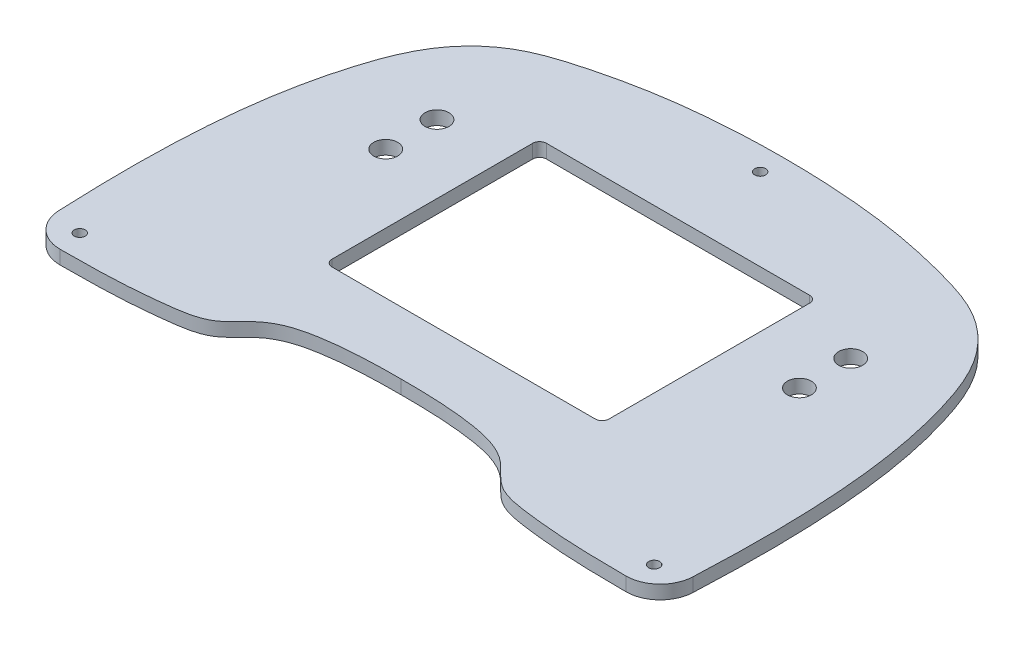
from build123d import *

# Parameters (mm, degrees)
SKETCH1_W           = 240
SKETCH1_H           = 310
BOSS_EXTRUDE1_DEPTH = 4
CUT_EXTRUDE1_REACH  = 198.064
SKETCH2_R           = 1.75
CUT_EXTRUDE2_REACH  = 198.064
SKETCH3_R           = 1.75
FILLET3_R           = 3
SKETCH4_R           = 1.6
CUT_EXTRUDE3_DEPTH  = 5
FILLET4_R           = 10
SKETCH5_R           = 1.6
CUT_EXTRUDE4_DEPTH  = 168.426582877
SKETCH6_W           = 37.6
SKETCH6_H           = 62.7
SKETCH6_W_2         = 5.8
CUT_EXTRUDE5_DEPTH  = 168.426582877
SKETCH7_R           = 3.5
CUT_EXTRUDE6_DEPTH  = 168.426582877
FILLET5_R           = 2


with BuildPart() as part:
    # Sketch1 → Boss-Extrude1 (new body)
    with BuildSketch(Plane(origin=(0, 0, 0), x_dir=(1, 0, 0), z_dir=(0, 1, 0))):
        Rectangle(SKETCH1_W, SKETCH1_H)
    extrude(amount=BOSS_EXTRUDE1_DEPTH)

    # Sketch2 → Cut-Extrude1 (cut, up to next)
    with BuildSketch(Plane(origin=(0, 4, 0), x_dir=(1, 0, 0), z_dir=(0, 1, 0)), mode=Mode.PRIVATE) as cut_extrude1_sk1:
        with BuildLine():
            Line((-120, 155), (-120, 0))
            add(Edge.make_bspline(
                [(0, 155), (-30.572222193, 155), (-80.343316982, 153.733320995), (-119.221157946, 117.654395612), (-120, 45.41001223), (-120, 0)],
                knots=[0, 0, 0, 0, 0.458017491, 0.558017491, 1, 1, 1, 1], degree=3))
            Line((0, 155), (-120, 155))
        make_face()
    cut_extrude1_tool1 = extrude(cut_extrude1_sk1.sketch, amount=-CUT_EXTRUDE1_REACH, mode=Mode.PRIVATE) & part.part
    # Sketch2 → Cut-Extrude1 (cut, up to next)
    with BuildSketch(Plane(origin=(0, 4, 0), x_dir=(1, 0, 0), z_dir=(0, 1, 0)), mode=Mode.PRIVATE) as cut_extrude1_sk2:
        with BuildLine():
            add(Edge.make_bspline(
                [(0, 155), (30.572222193, 155), (80.343316982, 153.733320995), (119.221157946, 117.654395612), (120, 45.41001223), (120, 0)],
                knots=[0, 0, 0, 0, 0.458017491, 0.558017491, 1, 1, 1, 1], degree=3))
            Line((120, 0), (120, 155))
            Line((120, 155), (0, 155))
        make_face()
    cut_extrude1_tool2 = extrude(cut_extrude1_sk2.sketch, amount=-CUT_EXTRUDE1_REACH, mode=Mode.PRIVATE) & part.part
    # Sketch2 → Cut-Extrude1 (cut, up to next)
    with BuildSketch(Plane(origin=(0, 4, 0), x_dir=(1, 0, 0), z_dir=(0, 1, 0)), mode=Mode.PRIVATE) as cut_extrude1_sk3:
        with BuildLine():
            Line((120, -155), (120, 0))
            add(Edge.make_bspline(
                [(0, -155), (30.572222193, -155), (80.343316982, -153.733320995), (119.221157946, -117.654395612), (120, -45.41001223), (120, 0)],
                knots=[0, 0, 0, 0, 0.458017491, 0.558017491, 1, 1, 1, 1], degree=3))
            Line((0, -155), (120, -155))
        make_face()
    cut_extrude1_tool3 = extrude(cut_extrude1_sk3.sketch, amount=-CUT_EXTRUDE1_REACH, mode=Mode.PRIVATE) & part.part
    # Sketch2 → Cut-Extrude1 (cut, up to next)
    with BuildSketch(Plane(origin=(0, 4, 0), x_dir=(1, 0, 0), z_dir=(0, 1, 0)), mode=Mode.PRIVATE) as cut_extrude1_sk4:
        with BuildLine():
            add(Edge.make_bspline(
                [(0, -155), (-30.572222193, -155), (-80.343316982, -153.733320995), (-119.221157946, -117.654395612), (-120, -45.41001223), (-120, 0)],
                knots=[0, 0, 0, 0, 0.458017491, 0.558017491, 1, 1, 1, 1], degree=3))
            Line((-120, 0), (-120, -155))
            Line((-120, -155), (0, -155))
        make_face()
    cut_extrude1_tool4 = extrude(cut_extrude1_sk4.sketch, amount=-CUT_EXTRUDE1_REACH, mode=Mode.PRIVATE) & part.part
    # Sketch2 → Cut-Extrude1 (cut, up to next)
    with BuildSketch(Plane(origin=(0, 4, 0), x_dir=(1, 0, 0), z_dir=(0, 1, 0)), mode=Mode.PRIVATE) as cut_extrude1_sk5:
        with Locations(Location((-88.957037006, 132.338171163, 0), (0, 0, 270))):
            Circle(SKETCH2_R)
    cut_extrude1_tool5 = extrude(cut_extrude1_sk5.sketch, amount=-CUT_EXTRUDE1_REACH, mode=Mode.PRIVATE) & part.part
    # Sketch2 → Cut-Extrude1 (cut, up to next)
    with BuildSketch(Plane(origin=(0, 4, 0), x_dir=(1, 0, 0), z_dir=(0, 1, 0)), mode=Mode.PRIVATE) as cut_extrude1_sk6:
        with Locations(Location((0, 146, 0), (0, 0, 270))):
            Circle(SKETCH2_R)
    cut_extrude1_tool6 = extrude(cut_extrude1_sk6.sketch, amount=-CUT_EXTRUDE1_REACH, mode=Mode.PRIVATE) & part.part
    # Sketch2 → Cut-Extrude1 (cut, up to next)
    with BuildSketch(Plane(origin=(0, 4, 0), x_dir=(1, 0, 0), z_dir=(0, 1, 0)), mode=Mode.PRIVATE) as cut_extrude1_sk7:
        with Locations(Location((88.957037006, 132.338171163, 0), (0, 0, 270))):
            Circle(SKETCH2_R)
    cut_extrude1_tool7 = extrude(cut_extrude1_sk7.sketch, amount=-CUT_EXTRUDE1_REACH, mode=Mode.PRIVATE) & part.part
    # Sketch2 → Cut-Extrude1 (cut, up to next)
    with BuildSketch(Plane(origin=(0, 4, 0), x_dir=(1, 0, 0), z_dir=(0, 1, 0)), mode=Mode.PRIVATE) as cut_extrude1_sk8:
        with Locations(Location((-110.418476952, 44.934472183, 0), (0, 0, 270))):
            Circle(SKETCH2_R)
    cut_extrude1_tool8 = extrude(cut_extrude1_sk8.sketch, amount=-CUT_EXTRUDE1_REACH, mode=Mode.PRIVATE) & part.part
    # Sketch2 → Cut-Extrude1 (cut, up to next)
    with BuildSketch(Plane(origin=(0, 4, 0), x_dir=(1, 0, 0), z_dir=(0, 1, 0)), mode=Mode.PRIVATE) as cut_extrude1_sk9:
        with Locations(Location((-49, -30, 0), (0, 0, 270))):
            Circle(SKETCH2_R)
    cut_extrude1_tool9 = extrude(cut_extrude1_sk9.sketch, amount=-CUT_EXTRUDE1_REACH, mode=Mode.PRIVATE) & part.part
    # Sketch2 → Cut-Extrude1 (cut, up to next)
    with BuildSketch(Plane(origin=(0, 4, 0), x_dir=(1, 0, 0), z_dir=(0, 1, 0)), mode=Mode.PRIVATE) as cut_extrude1_sk10:
        with Locations(Location((49, -30, 0), (0, 0, 270))):
            Circle(SKETCH2_R)
    cut_extrude1_tool10 = extrude(cut_extrude1_sk10.sketch, amount=-CUT_EXTRUDE1_REACH, mode=Mode.PRIVATE) & part.part
    # Sketch2 → Cut-Extrude1 (cut, up to next)
    with BuildSketch(Plane(origin=(0, 4, 0), x_dir=(1, 0, 0), z_dir=(0, 1, 0)), mode=Mode.PRIVATE) as cut_extrude1_sk11:
        with Locations(Location((-88.957037006, -132.338171163, 0), (0, 0, 270))):
            Circle(SKETCH2_R)
    cut_extrude1_tool11 = extrude(cut_extrude1_sk11.sketch, amount=-CUT_EXTRUDE1_REACH, mode=Mode.PRIVATE) & part.part
    # Sketch2 → Cut-Extrude1 (cut, up to next)
    with BuildSketch(Plane(origin=(0, 4, 0), x_dir=(1, 0, 0), z_dir=(0, 1, 0)), mode=Mode.PRIVATE) as cut_extrude1_sk12:
        with Locations(Location((0, -146, 0), (0, 0, 270))):
            Circle(SKETCH2_R)
    cut_extrude1_tool12 = extrude(cut_extrude1_sk12.sketch, amount=-CUT_EXTRUDE1_REACH, mode=Mode.PRIVATE) & part.part
    # Sketch2 → Cut-Extrude1 (cut, up to next)
    with BuildSketch(Plane(origin=(0, 4, 0), x_dir=(1, 0, 0), z_dir=(0, 1, 0)), mode=Mode.PRIVATE) as cut_extrude1_sk13:
        with Locations(Location((88.957037006, -132.338171163, 0), (0, 0, 270))):
            Circle(SKETCH2_R)
    cut_extrude1_tool13 = extrude(cut_extrude1_sk13.sketch, amount=-CUT_EXTRUDE1_REACH, mode=Mode.PRIVATE) & part.part
    # Sketch2 → Cut-Extrude1 (cut, up to next)
    with BuildSketch(Plane(origin=(0, 4, 0), x_dir=(1, 0, 0), z_dir=(0, 1, 0)), mode=Mode.PRIVATE) as cut_extrude1_sk14:
        with Locations(Location((110.418476952, 44.934472183, 0), (0, 0, 270))):
            Circle(SKETCH2_R)
    cut_extrude1_tool14 = extrude(cut_extrude1_sk14.sketch, amount=-CUT_EXTRUDE1_REACH, mode=Mode.PRIVATE) & part.part
    add(cut_extrude1_tool1.solids().sort_by_distance((-102.173006, 4, -133.115769))[0], mode=Mode.SUBTRACT)
    add(cut_extrude1_tool2.solids().sort_by_distance((102.087926, 4, -133.133004))[0], mode=Mode.SUBTRACT)
    add(cut_extrude1_tool3.solids().sort_by_distance((102.087926, 4, 133.133004))[0], mode=Mode.SUBTRACT)
    add(cut_extrude1_tool4.solids().sort_by_distance((-102.173006, 4, 133.115769))[0], mode=Mode.SUBTRACT)
    add(cut_extrude1_tool5.solids().sort_by_distance((-88.957037, 4, -132.338171))[0], mode=Mode.SUBTRACT)
    add(cut_extrude1_tool6.solids().sort_by_distance((0, 4, -146))[0], mode=Mode.SUBTRACT)
    add(cut_extrude1_tool7.solids().sort_by_distance((88.957037, 4, -132.338171))[0], mode=Mode.SUBTRACT)
    add(cut_extrude1_tool8.solids().sort_by_distance((-110.418477, 4, -44.934472))[0], mode=Mode.SUBTRACT)
    add(cut_extrude1_tool9.solids().sort_by_distance((-49, 4, 30))[0], mode=Mode.SUBTRACT)
    add(cut_extrude1_tool10.solids().sort_by_distance((49, 4, 30))[0], mode=Mode.SUBTRACT)
    add(cut_extrude1_tool11.solids().sort_by_distance((-88.957037, 4, 132.338171))[0], mode=Mode.SUBTRACT)
    add(cut_extrude1_tool12.solids().sort_by_distance((0, 4, 146))[0], mode=Mode.SUBTRACT)
    add(cut_extrude1_tool13.solids().sort_by_distance((88.957037, 4, 132.338171))[0], mode=Mode.SUBTRACT)
    add(cut_extrude1_tool14.solids().sort_by_distance((110.418477, 4, -44.934472))[0], mode=Mode.SUBTRACT)

    # Sketch3 → Cut-Extrude2 (cut, up to next)
    with BuildSketch(Plane(origin=(0, 4, 0), x_dir=(1, 0, 0), z_dir=(0, 1, 0)), mode=Mode.PRIVATE) as cut_extrude2_sk1:
        with BuildLine():
            Line((-120, 0), (120, 0))
            add(Edge.make_bspline(
                [(0, -155), (30.572222193, -155), (80.343316982, -153.733320995), (119.221157946, -117.654395612), (120, -45.41001223), (120, 0)],
                knots=[0, 0, 0, 0, 0.458017491, 0.558017491, 1, 1, 1, 1], degree=3))
            add(Edge.make_bspline(
                [(-120, 0), (-120, -45.41001223), (-119.221157946, -117.654395612), (-80.343316982, -153.733320995), (-30.572222193, -155), (0, -155)],
                knots=[0, 0, 0, 0, 0.441982509, 0.541982509, 1, 1, 1, 1], degree=3))
        make_face()
        with Locations((88.957037006, -132.338171163)):
            Circle(SKETCH3_R, mode=Mode.SUBTRACT)
        with Locations((49, -30)):
            Circle(SKETCH3_R, mode=Mode.SUBTRACT)
        with Locations((-88.957037006, -132.338171163)):
            Circle(SKETCH3_R, mode=Mode.SUBTRACT)
        with Locations((-49, -30)):
            Circle(SKETCH3_R, mode=Mode.SUBTRACT)
        with Locations((0, -146)):
            Circle(SKETCH3_R, mode=Mode.SUBTRACT)
    cut_extrude2_tool1 = extrude(cut_extrude2_sk1.sketch, amount=-CUT_EXTRUDE2_REACH, mode=Mode.PRIVATE) & part.part
    # Sketch3 → Cut-Extrude2 (cut, up to next)
    with BuildSketch(Plane(origin=(0, 4, 0), x_dir=(1, 0, 0), z_dir=(0, 1, 0)), mode=Mode.PRIVATE) as cut_extrude2_sk2:
        with BuildLine():
            add(Edge.make_bspline(
                [(-119.996868981, 5), (-119.999161826, 3.317063079), (-120, 1.649620662), (-120, 0)],
                knots=[0.983943993, 0.983943993, 0.983943993, 0.983943993, 1, 1, 1, 1], degree=3))
            Line((-120, 0), (120, 0))
            add(Edge.make_bspline(
                [(120, 0), (120, 1.649620662), (119.999161826, 3.317063079), (119.996868981, 5)],
                knots=[0, 0, 0, 0, 0.016056007, 0.016056007, 0.016056007, 0.016056007], degree=3))
            Line((119.996868981, 5), (-119.996868981, 5))
        make_face()
    cut_extrude2_tool2 = extrude(cut_extrude2_sk2.sketch, amount=-CUT_EXTRUDE2_REACH, mode=Mode.PRIVATE) & part.part
    add(cut_extrude2_tool1.solids().sort_by_distance((0, 4, 73.058016))[0], mode=Mode.SUBTRACT)
    add(cut_extrude2_tool2.solids().sort_by_distance((0, 4, -2.499989))[0], mode=Mode.SUBTRACT)

    # Fillet3
    fillet3_edges = [part.edges().sort_by_distance(p)[0] for p in [
        (119.996868981, 2, -5),
        (-119.996868981, 2, -5),
    ]]
    fillet(fillet3_edges, radius=FILLET3_R)

    # Sketch4 → Cut-Extrude3 (cut)
    # profile 1 of 2: a face of its own
    with BuildSketch(Plane(origin=(0, 4, 0), x_dir=(1, 0, 0), z_dir=(0, 1, 0))):
        with BuildLine():
            ThreePointArc((-119.991132673, 8.007468224), (-119.115101087, 5.881321718), (-116.991141968, 5))
            Line((-116.991141968, 5), (116.991141968, 5))
            ThreePointArc((116.991141968, 5), (119.115101087, 5.881321718), (119.991132673, 8.007468224))
            add(Edge.make_bspline(
                [(0, 155), (30.572222193, 155), (80.343316982, 153.733320995), (118.227056859, 118.576928811), (119.881344424, 52.109482017), (119.991132673, 8.007468224)],
                knots=[0, 0, 0, 0, 0.458017491, 0.558017491, 0.974430136, 0.974430136, 0.974430136, 0.974430136], degree=3))
            add(Edge.make_bspline(
                [(0, 155), (-30.572222193, 155), (-80.343316982, 153.733320995), (-118.227056859, 118.576928811), (-119.881344424, 52.109482017), (-119.991132673, 8.007468224)],
                knots=[0, 0, 0, 0, 0.458017491, 0.558017491, 0.974430136, 0.974430136, 0.974430136, 0.974430136], degree=3))
        make_face()
        with BuildLine():
            add(Edge.make_bspline(
                [(-92.233514507, 10), (-80.664301387, 10), (-67.379754657, 9.832976348), (-50.821281342, 11.756445914), (-41.687640008, 13.092793482), (-34.61054209, 23.0328201), (-19.157922754, 26.773253881), (-6.717349602, 27), (0, 27)],
                knots=[0, 0, 0, 0, 0.354854857, 0.417368962, 0.525089505, 0.626100692, 0.774450144, 1, 1, 1, 1], degree=3))
            add(Edge.make_bspline(
                [(-92.233514507, 10), (-93.109031306, 24.461653993), (-94.141297679, 55.929427893), (-89.848799736, 89.042535108), (-82.77661836, 109.219212766), (-77.505758875, 118.879248593), (-67.56067431, 127.964233668), (-51.20251433, 133.204450958), (-28.956327731, 138.000468293), (-10.500871466, 139), (0, 139)],
                knots=[0.048683265, 0.048683265, 0.048683265, 0.048683265, 0.273512027, 0.499348708, 0.541604418, 0.589205488, 0.661188988, 0.734095029, 0.840040992, 1, 1, 1, 1], degree=3))
            add(Edge.make_bspline(
                [(92.233514507, 10), (93.109031306, 24.461653993), (94.141297679, 55.929427893), (89.848799736, 89.042535108), (82.77661836, 109.219212766), (77.505758875, 118.879248593), (67.56067431, 127.964233668), (51.20251433, 133.204450958), (28.956327731, 138.000468293), (10.500871466, 139), (0, 139)],
                knots=[0.048683265, 0.048683265, 0.048683265, 0.048683265, 0.273512027, 0.499348708, 0.541604418, 0.589205488, 0.661188988, 0.734095029, 0.840040992, 1, 1, 1, 1], degree=3))
            add(Edge.make_bspline(
                [(92.233514507, 10), (80.664301387, 10), (67.379754657, 9.832976348), (50.821281342, 11.756445914), (41.687640008, 13.092793482), (34.61054209, 23.0328201), (19.157922754, 26.773253881), (6.717349602, 27), (0, 27)],
                knots=[0, 0, 0, 0, 0.354854857, 0.417368962, 0.525089505, 0.626100692, 0.774450144, 1, 1, 1, 1], degree=3))
        make_face(mode=Mode.SUBTRACT)
    # profile 2 of 2: a face of its own
    with BuildSketch(Plane(origin=(0, 4, 0), x_dir=(1, 0, 0), z_dir=(0, 1, 0))):
        with Locations(Location((0, 132, 0), (0, 0, 270))):
            Circle(SKETCH4_R)
    extrude(amount=-CUT_EXTRUDE3_DEPTH, mode=Mode.SUBTRACT)

    # Fillet4
    fillet4_edges = [part.edges().sort_by_distance(p)[0] for p in [
        (92.233514507, 2, -10),
        (-92.233514507, 2, -10),
    ]]
    fillet(fillet4_edges, radius=FILLET4_R)

    # Sketch5 → Cut-Extrude4 (cut, through all)
    with BuildSketch(Plane(origin=(0, 4, 0), x_dir=(1, 0, 0), z_dir=(0, 1, 0))):
        with Locations(Location((-84, 17, 0), (0, 0, 270))):
            Circle(SKETCH5_R)
        with Locations(Location((84, 17, 0), (0, 0, 270))):
            Circle(SKETCH5_R)
    extrude(amount=-CUT_EXTRUDE4_DEPTH, mode=Mode.SUBTRACT)

    # Sketch6 → Cut-Extrude5 (cut, through all)
    with BuildSketch(Plane(origin=(0, 4, 0), x_dir=(1, 0, 0), z_dir=(0, 1, 0))):
        with Locations((-21.7, 76.62)):
            Rectangle(SKETCH6_W, SKETCH6_H)
        with Locations((0, 76.62)):
            Rectangle(SKETCH6_W_2, SKETCH6_H)
        with Locations((21.7, 76.62)):
            Rectangle(SKETCH6_W, SKETCH6_H)
    extrude(amount=-CUT_EXTRUDE5_DEPTH, mode=Mode.SUBTRACT)

    # Sketch7 → Cut-Extrude6 (cut, through all)
    with BuildSketch(Plane(origin=(0, 4, 0), x_dir=(1, 0, 0), z_dir=(0, 1, 0))):
        with Locations(Location((60.5, 97.97, 0), (0, 0, 270))):
            Circle(SKETCH7_R)
        with Locations(Location((-60.5, 97.97, 0), (0, 0, 90))):
            Circle(SKETCH7_R)
        with Locations(Location((60.5, 82.97, 0), (0, 0, 270))):
            Circle(SKETCH7_R)
        with Locations(Location((-60.5, 82.97, 0), (0, 0, 90))):
            Circle(SKETCH7_R)
    extrude(amount=-CUT_EXTRUDE6_DEPTH, mode=Mode.SUBTRACT)

    # Fillet5
    fillet5_edges = [part.edges().sort_by_distance(p)[0] for p in [
        (40.5, 2, -45.27),
        (-40.5, 2, -45.27),
        (-40.5, 2, -107.97),
        (40.5, 2, -107.97),
    ]]
    fillet(fillet5_edges, radius=FILLET5_R)


solid = part.part
